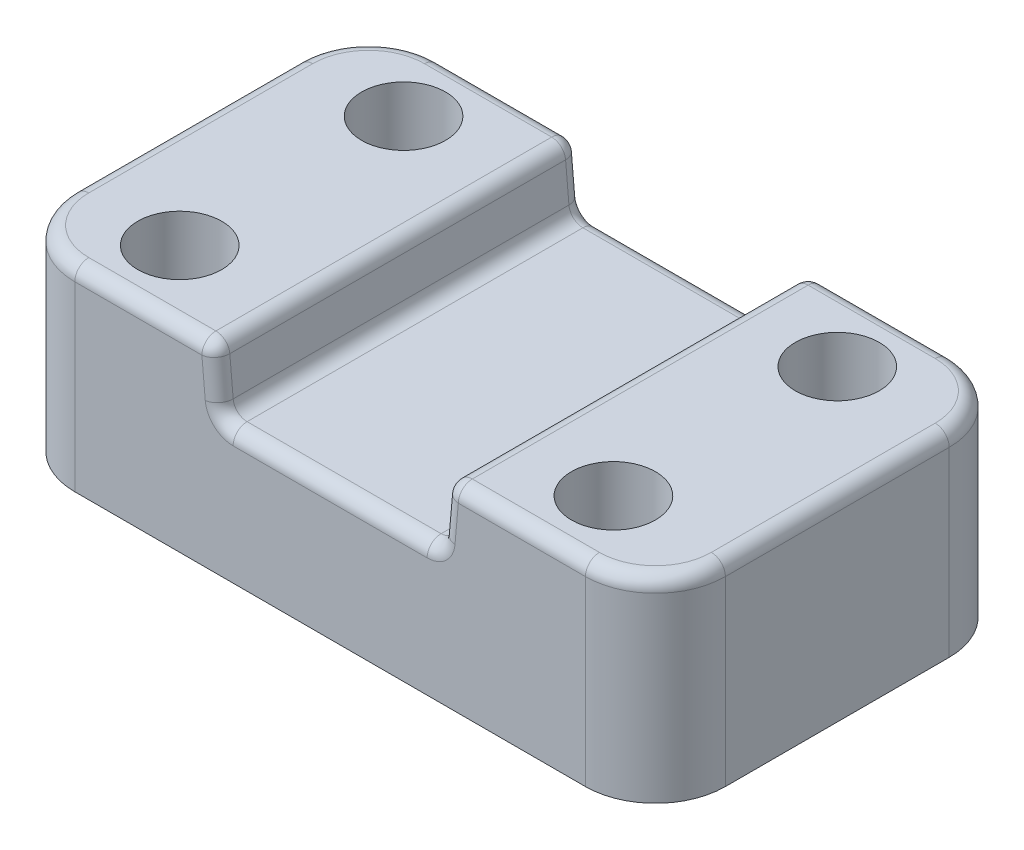
from build123d import *

# Parameters (mm, degrees)
SKETCH2_W             = 46.5
SKETCH2_H             = 26
BOSS_EXTRUDE1_DEPTH   = 14
CUT_EXTRUDE1_DEPTH    = 40.354955215
FILLET1_R             = 5
FILLET2_R             = 1
F_6_0MM_DOWEL_HOLE1_D = 6


with BuildPart() as part:
    # Sketch2 → Boss-Extrude1 (new body)
    with BuildSketch(Plane(origin=(0, 0, 0), x_dir=(1, 0, 0), z_dir=(0, 1, 0))):
        Rectangle(SKETCH2_W, SKETCH2_H)
    extrude(amount=BOSS_EXTRUDE1_DEPTH)

    # Sketch5 → Cut-Extrude1 (cut, through all)
    with BuildSketch(Plane.XY.offset(15.5)):
        Polygon((-8.25, 14), (-7.848214286, 9.5), (7.848214286, 9.5), (8.25, 14), align=None)
    extrude(amount=-CUT_EXTRUDE1_DEPTH, mode=Mode.SUBTRACT)

    # Fillet1
    fillet1_edges = [part.edges().sort_by_distance(p)[0] for p in [
        (-23.25, 7, -13),
        (23.25, 7, -13),
        (23.25, 7, 13),
        (-23.25, 7, 13),
    ]]
    fillet(fillet1_edges, radius=FILLET1_R)

    # Fillet2
    fillet2_edges = [part.edges().sort_by_distance(p)[0] for p in [
        (13.25, 14, 13),
        (-13.25, 14, -13),
        (-8.25, 14, 0),
        (7.848214286, 9.5, 0),
        (0, 9.5, 13),
        (0, 9.5, -13),
        (-7.848214286, 9.5, 0),
        (-8.049107143, 11.75, 13),
        (-8.049107143, 11.75, -13),
        (8.25, 14, 0),
        (8.049107143, 11.75, 13),
        (8.049107143, 11.75, -13),
        (13.25, 14, -13),
        (23.25, 14, 0),
        (21.785533906, 14, 11.535533906),
        (21.785533906, 14, -11.535533906),
        (-13.25, 14, 13),
        (-23.25, 14, 0),
        (-21.785533906, 14, 11.535533906),
        (-21.785533906, 14, -11.535533906),
    ]]
    fillet(fillet2_edges, radius=FILLET2_R)

    # Ø6.0mm Dowel Hole1 (through all)
    with Locations(Plane(origin=(0, 14, 0), x_dir=(1, 0, 0), z_dir=(0, 1, 0))):
        with Locations((15.25, 8), (15.25, -8), (-15.75, -8), (-15.75, 8)):
            Hole(F_6_0MM_DOWEL_HOLE1_D / 2)


solid = part.part
